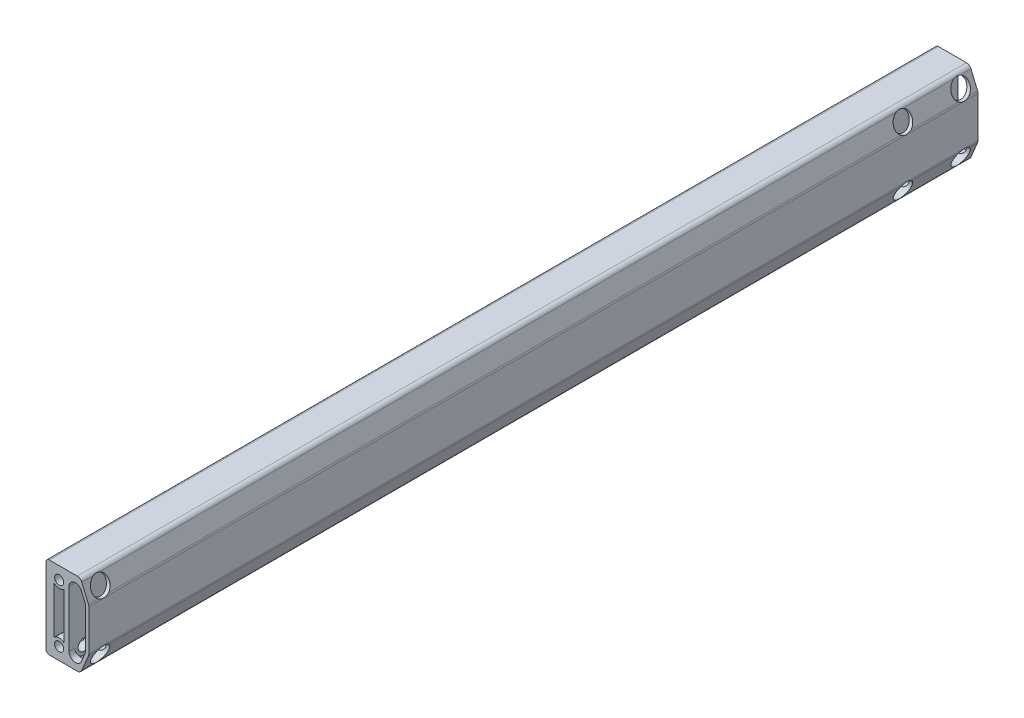
from build123d import *

# Parameters (mm, degrees)
SKETCH_1_R          = 2.75
EXTRUDE_1_DEPTH     = 540
CUT_EXTRUDE_2_DEPTH = 2.5
SKETCH_3_R          = 3.5
CUT_EXTRUDE_3_DEPTH = 1297.387836991
SKETCH_4_R          = 5.5
CUT_EXTRUDE_4_DEPTH = 12


with BuildPart() as part:
    # 草图1 → 拉伸1 (new body)
    with BuildSketch(Plane.XY):
        with BuildLine():
            Line((1279.954850036, 1143.28070675), (1279.954850036, 1130.28070675))
            ThreePointArc((1279.954850036, 1130.28070675), (1280.540636473, 1128.866493188), (1281.954850036, 1128.28070675))
            Line((1281.954850036, 1128.28070675), (1298.954850036, 1128.28070675))
            ThreePointArc((1298.954850036, 1128.28070675), (1300.618950624, 1128.784555867), (1301.724080805, 1130.126860596))
            Line((1301.724080805, 1130.126860596), (1305.724080805, 1139.726860596))
            ThreePointArc((1305.724080805, 1139.726860596), (1305.896592063, 1140.292358345), (1305.954850036, 1140.88070675))
            Line((1305.954850036, 1140.88070675), (1305.954850036, 1165.68070675))
            ThreePointArc((1305.954850036, 1165.68070675), (1305.896592063, 1166.269055155), (1305.724080805, 1166.834552904))
            Line((1305.724080805, 1166.834552904), (1301.724080805, 1176.434552904))
            ThreePointArc((1301.724080805, 1176.434552904), (1300.618950624, 1177.776857633), (1298.954850036, 1178.28070675))
            Line((1298.954850036, 1178.28070675), (1281.954850036, 1178.28070675))
            ThreePointArc((1281.954850036, 1178.28070675), (1280.540636473, 1177.694920312), (1279.954850036, 1176.28070675))
            Line((1279.954850036, 1176.28070675), (1279.954850036, 1163.28070675))
            Line((1279.954850036, 1163.28070675), (1279.954850036, 1143.28070675))
        make_face()
        with Locations((1287.954850036, 1135.78070675)):
            Circle(SKETCH_1_R, mode=Mode.SUBTRACT)
        with Locations((1287.954850036, 1170.78070675)):
            Circle(SKETCH_1_R, mode=Mode.SUBTRACT)
        with BuildLine():
            Line((1284.954850036, 1167.426604784), (1284.954850036, 1139.134808716))
            ThreePointArc((1284.954850036, 1139.134808716), (1287.954850036, 1140.28070675), (1290.954850036, 1139.134808716))
            Line((1290.954850036, 1139.134808716), (1290.954850036, 1167.426604784))
            ThreePointArc((1290.954850036, 1167.426604784), (1287.954850036, 1166.28070675), (1284.954850036, 1167.426604784))
        make_face(mode=Mode.SUBTRACT)
        with BuildLine():
            Line((1293.954850036, 1170.38070675), (1293.954850036, 1136.18070675))
            ThreePointArc((1293.954850036, 1136.18070675), (1297.089997109, 1132.356442115), (1301.454850036, 1134.68070675))
            Line((1301.454850036, 1134.68070675), (1303.877926959, 1140.496091365))
            ThreePointArc((1303.877926959, 1140.496091365), (1303.935430711, 1140.684590615), (1303.954850036, 1140.88070675))
            Line((1303.954850036, 1140.88070675), (1303.954850036, 1165.68070675))
            ThreePointArc((1303.954850036, 1165.68070675), (1303.935430711, 1165.876822885), (1303.877926959, 1166.065322135))
            Line((1303.877926959, 1166.065322135), (1301.454850036, 1171.88070675))
            ThreePointArc((1301.454850036, 1171.88070675), (1297.089997109, 1174.204971385), (1293.954850036, 1170.38070675))
        make_face(mode=Mode.SUBTRACT)
    extrude(amount=-EXTRUDE_1_DEPTH)

    # 草图2 → 拉伸2 (cut)
    with BuildSketch(Plane.ZY.offset(-1279.954850036)):
        with BuildLine():
            Line((-540, 1163.28070675), (-485, 1163.28070675))
            ThreePointArc((-485, 1163.28070675), (-475, 1153.28070675), (-485, 1143.28070675))
            Line((-485, 1143.28070675), (-540, 1143.28070675))
            Line((-540, 1143.28070675), (-540, 1163.28070675))
        make_face()
    extrude(amount=-CUT_EXTRUDE_2_DEPTH, mode=Mode.SUBTRACT)

    # 草图3 → 拉伸3 (cut, through all)
    with BuildSketch(Plane(origin=(1305.954850036, 0, 0), x_dir=(0, 0, -1), z_dir=(1, 0, 0))):
        with Locations(Location((531.5, 1171.28070675, 0), (0, 0, 90))):
            Circle(SKETCH_3_R)
        with Locations(Location((496.5, 1171.28070675, 0), (0, 0, 90))):
            Circle(SKETCH_3_R)
        with Locations(Location((531.5, 1135.28070675, 0), (0, 0, 90))):
            Circle(SKETCH_3_R)
        with Locations(Location((496.5, 1135.28070675, 0), (0, 0, 90))):
            Circle(SKETCH_3_R)
        with Locations(Location((9, 1171.28070675, 0), (0, 0, 90))):
            Circle(SKETCH_3_R)
        with Locations(Location((9, 1135.28070675, 0), (0, 0, 90))):
            Circle(SKETCH_3_R)
    extrude(amount=-CUT_EXTRUDE_3_DEPTH, mode=Mode.SUBTRACT)

    # 草图4 → 拉伸4 (cut)
    with BuildSketch(Plane(origin=(1305.954850036, 0, 0), x_dir=(0, 0, -1), z_dir=(1, 0, 0))):
        with Locations(Location((496.5, 1171.28070675, 0), (0, 0, 110.435975903))):
            Circle(SKETCH_4_R)
        with Locations(Location((531.5, 1171.28070675, 0), (0, 0, 69.564033963))):
            Circle(SKETCH_4_R)
        with Locations(Location((496.5, 1135.28070675, 0), (0, 0, 108.512979862))):
            Circle(SKETCH_4_R)
        with Locations(Location((531.5, 1135.28070675, 0), (0, 0, 108.512979231))):
            Circle(SKETCH_4_R)
        with Locations(Location((9, 1171.28070675, 0), (0, 0, 69.564033963))):
            Circle(SKETCH_4_R)
        with Locations(Location((9, 1135.28070675, 0), (0, 0, 108.512979231))):
            Circle(SKETCH_4_R)
    extrude(amount=-CUT_EXTRUDE_4_DEPTH, mode=Mode.SUBTRACT)


solid = part.part
